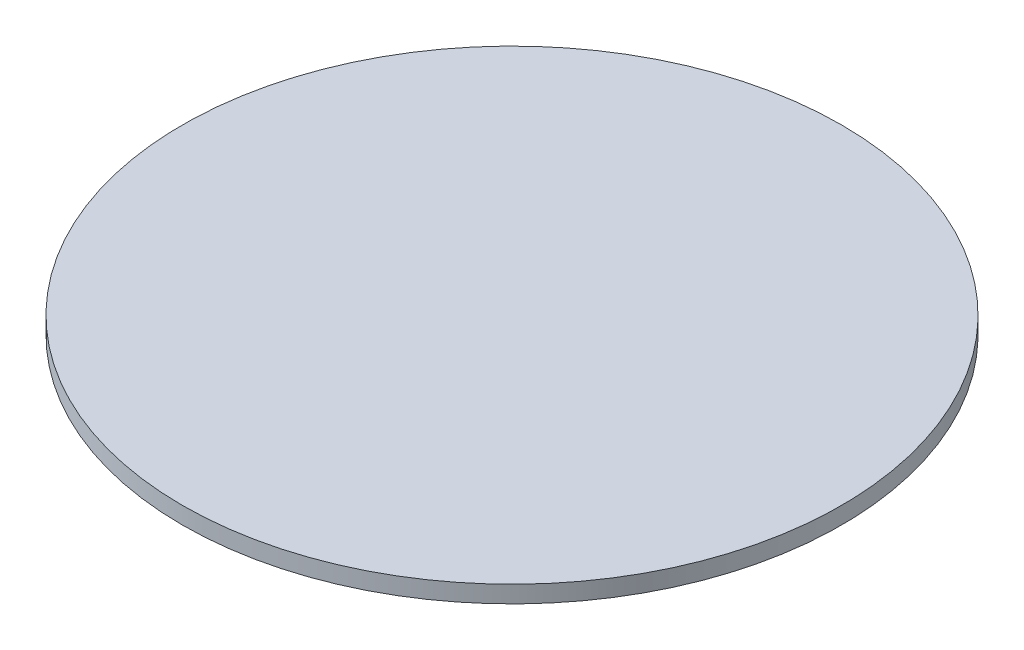
from build123d import *

# Parameters (mm, degrees)
SKETCH_1_R      = 29
EXTRUDE_1_DEPTH = 1.5


with BuildPart() as part:
    # Эскиз1 → Бобышка-Вытянуть1 (new body)
    with BuildSketch(Plane(origin=(0, 0, 0), x_dir=(1, 0, 0), z_dir=(0, 1, 0))):
        with Locations(Location((0, 0, 0), (0, 0, 270))):
            Circle(SKETCH_1_R)
    extrude(amount=EXTRUDE_1_DEPTH)


solid = part.part
